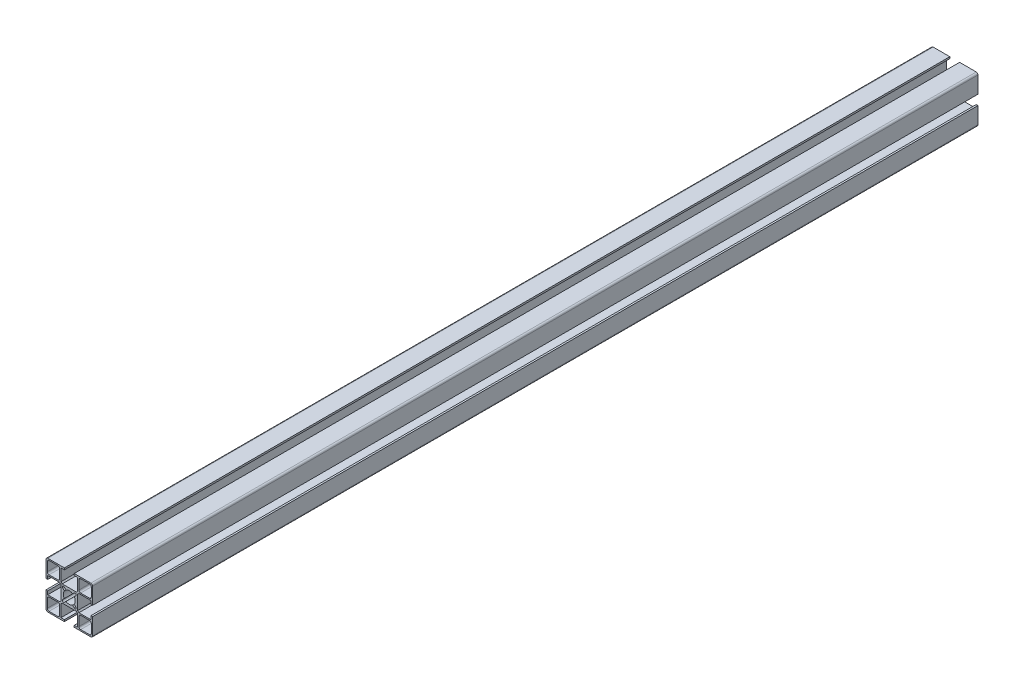
from build123d import *

# Parameters (mm, degrees)
EXTRUDE_1_DEPTH = 760


with BuildPart() as part:
    # 草图1 → 凸台-拉伸1 (new body)
    with BuildSketch(Plane.XY):
        with BuildLine():
            Line((-6.089339828, -7.15), (6.089339828, -7.15))
            Line((6.089339828, -7.15), (7.15, -8.210660172))
            Line((7.15, -8.210660172), (7.15, -18.5))
            Line((7.15, -18.5), (4.2, -18.5))
            Line((4.2, -18.5), (4.2, -20))
            Line((4.2, -20), (18.5, -20))
            ThreePointArc((18.5, -20), (19.560660172, -19.560660172), (20, -18.5))
            Line((20, -18.5), (20, -4.2))
            Line((20, -4.2), (18.5, -4.2))
            Line((18.5, -4.2), (18.5, -7.15))
            Line((18.5, -7.15), (8.210660172, -7.15))
            Line((8.210660172, -7.15), (7.15, -6.089339828))
            Line((7.15, -6.089339828), (7.15, 6.089339828))
            Line((7.15, 6.089339828), (8.210660172, 7.15))
            Line((8.210660172, 7.15), (18.5, 7.15))
            Line((18.5, 7.15), (18.5, 4.2))
            Line((18.5, 4.2), (20, 4.2))
            Line((20, 4.2), (20, 18.5))
            ThreePointArc((20, 18.5), (19.560660172, 19.560660172), (18.5, 20))
            Line((18.5, 20), (4.2, 20))
            Line((4.2, 20), (4.2, 18.5))
            Line((4.2, 18.5), (7.15, 18.5))
            Line((7.15, 18.5), (7.15, 8.210660172))
            Line((7.15, 8.210660172), (6.089339828, 7.15))
            Line((6.089339828, 7.15), (-6.089339828, 7.15))
            Line((-6.089339828, 7.15), (-7.15, 8.210660172))
            Line((-7.15, 8.210660172), (-7.15, 18.5))
            Line((-7.15, 18.5), (-4.2, 18.5))
            Line((-4.2, 18.5), (-4.2, 20))
            Line((-4.2, 20), (-18.5, 20))
            ThreePointArc((-18.5, 20), (-19.560660172, 19.560660172), (-20, 18.5))
            Line((-20, 18.5), (-20, 4.2))
            Line((-20, 4.2), (-18.5, 4.2))
            Line((-18.5, 4.2), (-18.5, 7.15))
            Line((-18.5, 7.15), (-8.210660172, 7.15))
            Line((-8.210660172, 7.15), (-7.15, 6.089339828))
            Line((-7.15, 6.089339828), (-7.15, -6.089339828))
            Line((-7.15, -6.089339828), (-8.210660172, -7.15))
            Line((-8.210660172, -7.15), (-18.5, -7.15))
            Line((-18.5, -7.15), (-18.5, -4.2))
            Line((-18.5, -4.2), (-20, -4.2))
            Line((-20, -4.2), (-20, -18.5))
            ThreePointArc((-20, -18.5), (-19.560660172, -19.560660172), (-18.5, -20))
            Line((-18.5, -20), (-4.2, -20))
            Line((-4.2, -20), (-4.2, -18.5))
            Line((-4.2, -18.5), (-7.15, -18.5))
            Line((-7.15, -18.5), (-7.15, -8.210660172))
            Line((-7.15, -8.210660172), (-6.089339828, -7.15))
        make_face()
        with BuildLine():
            Line((17.4, 8.25), (9.75, 8.25))
            ThreePointArc((9.75, 8.25), (8.689339828, 8.689339828), (8.25, 9.75))
            Line((8.25, 9.75), (8.25, 17.4))
            ThreePointArc((8.25, 17.4), (8.689339828, 18.460660172), (9.75, 18.9))
            Line((9.75, 18.9), (17.4, 18.9))
            ThreePointArc((17.4, 18.9), (18.460660172, 18.460660172), (18.9, 17.4))
            Line((18.9, 17.4), (18.9, 9.75))
            ThreePointArc((18.9, 9.75), (18.460660172, 8.689339828), (17.4, 8.25))
        make_face(mode=Mode.SUBTRACT)
        with BuildLine():
            Line((-8.25, 17.4), (-8.25, 9.75))
            ThreePointArc((-8.25, 9.75), (-8.689339828, 8.689339828), (-9.75, 8.25))
            Line((-9.75, 8.25), (-17.4, 8.25))
            ThreePointArc((-17.4, 8.25), (-18.460660172, 8.689339828), (-18.9, 9.75))
            Line((-18.9, 9.75), (-18.9, 17.4))
            ThreePointArc((-18.9, 17.4), (-18.460660172, 18.460660172), (-17.4, 18.9))
            Line((-17.4, 18.9), (-9.75, 18.9))
            ThreePointArc((-9.75, 18.9), (-8.689339828, 18.460660172), (-8.25, 17.4))
        make_face(mode=Mode.SUBTRACT)
        with BuildLine():
            Line((-17.4, -8.25), (-9.75, -8.25))
            ThreePointArc((-9.75, -8.25), (-8.689339828, -8.689339828), (-8.25, -9.75))
            Line((-8.25, -9.75), (-8.25, -17.4))
            ThreePointArc((-8.25, -17.4), (-8.689339828, -18.460660172), (-9.75, -18.9))
            Line((-9.75, -18.9), (-17.4, -18.9))
            ThreePointArc((-17.4, -18.9), (-18.460660172, -18.460660172), (-18.9, -17.4))
            Line((-18.9, -17.4), (-18.9, -9.75))
            ThreePointArc((-18.9, -9.75), (-18.460660172, -8.689339828), (-17.4, -8.25))
        make_face(mode=Mode.SUBTRACT)
        with BuildLine():
            Line((8.25, -17.4), (8.25, -9.75))
            ThreePointArc((8.25, -9.75), (8.689339828, -8.689339828), (9.75, -8.25))
            Line((9.75, -8.25), (17.4, -8.25))
            ThreePointArc((17.4, -8.25), (18.460660172, -8.689339828), (18.9, -9.75))
            Line((18.9, -9.75), (18.9, -17.4))
            ThreePointArc((18.9, -17.4), (18.460660172, -18.460660172), (17.4, -18.9))
            Line((17.4, -18.9), (9.75, -18.9))
            ThreePointArc((9.75, -18.9), (8.689339828, -18.460660172), (8.25, -17.4))
        make_face(mode=Mode.SUBTRACT)
        with BuildLine():
            Line((-4.243347723, 2.829134161), (-5.656854249, 4.242640687))
            ThreePointArc((-5.656854249, 4.242640687), (-5.656854249, 5.656854249), (-4.242640687, 5.656854249))
            Line((-4.242640687, 5.656854249), (-2.829134161, 4.243347723))
            ThreePointArc((-2.829134161, 4.243347723), (0, 5.1), (2.829134161, 4.243347723))
            Line((2.829134161, 4.243347723), (4.242640687, 5.656854249))
            ThreePointArc((4.242640687, 5.656854249), (5.656854249, 5.656854249), (5.656854249, 4.242640687))
            Line((5.656854249, 4.242640687), (4.243347723, 2.829134161))
            ThreePointArc((4.243347723, 2.829134161), (5.1, 0), (4.243347723, -2.829134161))
            Line((4.243347723, -2.829134161), (5.656854249, -4.242640687))
            ThreePointArc((5.656854249, -4.242640687), (5.656854249, -5.656854249), (4.242640687, -5.656854249))
            Line((4.242640687, -5.656854249), (2.829134161, -4.243347723))
            ThreePointArc((2.829134161, -4.243347723), (0, -5.1), (-2.829134161, -4.243347723))
            Line((-2.829134161, -4.243347723), (-4.242640687, -5.656854249))
            ThreePointArc((-4.242640687, -5.656854249), (-5.656854249, -5.656854249), (-5.656854249, -4.242640687))
            Line((-5.656854249, -4.242640687), (-4.243347723, -2.829134161))
            ThreePointArc((-4.243347723, -2.829134161), (-5.1, 0), (-4.243347723, 2.829134161))
        make_face(mode=Mode.SUBTRACT)
    extrude(amount=EXTRUDE_1_DEPTH)


solid = part.part
